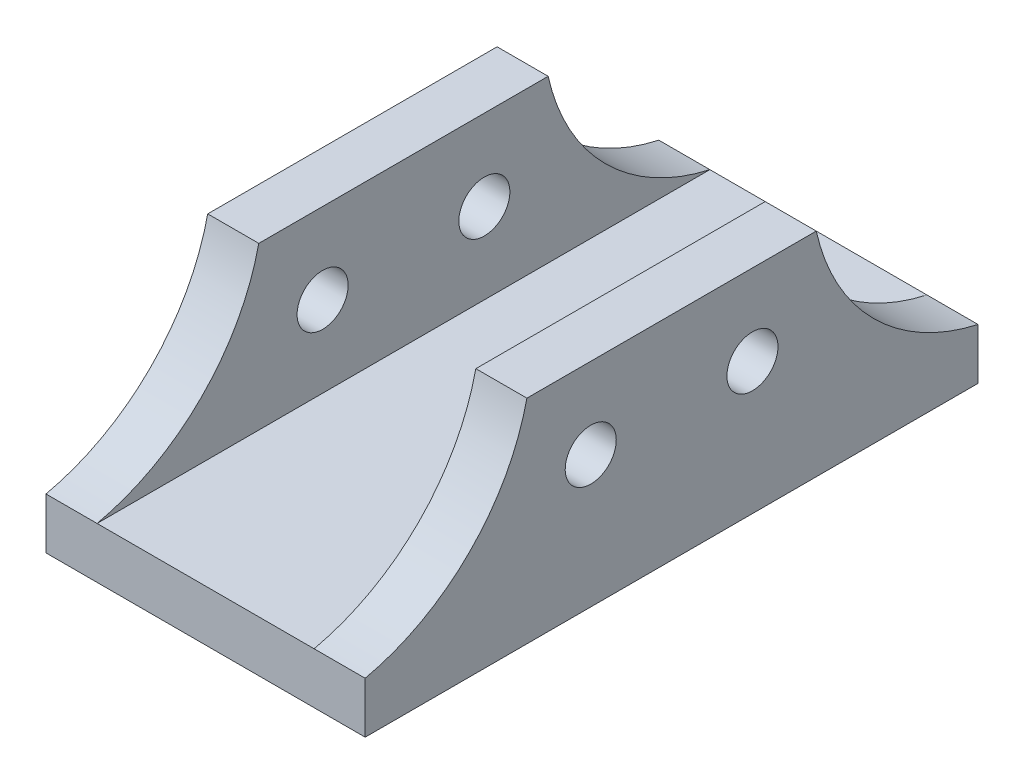
from build123d import *

# Parameters (mm, degrees)
SKETCH8_W           = 144
SKETCH8_H           = 50
SKETCH8_R           = 6
BOSS_EXTRUDE5_DEPTH = 37.5
SKETCH9_W           = 51
SKETCH9_H           = 38
CUT_EXTRUDE1_DEPTH  = 157.978501713
CUT_EXTRUDE2_DEPTH  = 116.364639296


with BuildPart() as part:
    # Sketch8 → Boss-Extrude5 (new, symmetric)
    with BuildSketch(Plane(origin=(0, 0, 0), x_dir=(0, 0, -1), z_dir=(1, 0, 0))):
        with Locations((0, 25)):
            Rectangle(SKETCH8_W, SKETCH8_H)
        with Locations((-19, 31)):
            Circle(SKETCH8_R, mode=Mode.SUBTRACT)
        with Locations((19, 31)):
            Circle(SKETCH8_R, mode=Mode.SUBTRACT)
    extrude(amount=BOSS_EXTRUDE5_DEPTH, both=True)

    # Sketch9 → Cut-Extrude1 (cut, through all)
    with BuildSketch(Plane.XY.offset(72)):
        with Locations((0, 31)):
            Rectangle(SKETCH9_W, SKETCH9_H)
    extrude(amount=-CUT_EXTRUDE1_DEPTH, mode=Mode.SUBTRACT)

    # Sketch10 → Cut-Extrude2 (cut, through all)
    with BuildSketch(Plane(origin=(37.5, 0, 0), x_dir=(0, 0, -1), z_dir=(1, 0, 0))):
        with BuildLine():
            Line((-72, 50), (-34, 50))
            ThreePointArc((-34, 50), (-47.460763972, 25.460763972), (-72, 12))
            Line((-72, 12), (-72, 50))
        make_face()
        with BuildLine():
            Line((72, 50), (34, 50))
            ThreePointArc((34, 50), (47.460763972, 25.460763972), (72, 12))
            Line((72, 12), (72, 50))
        make_face()
    extrude(amount=-CUT_EXTRUDE2_DEPTH, mode=Mode.SUBTRACT)


solid = part.part
